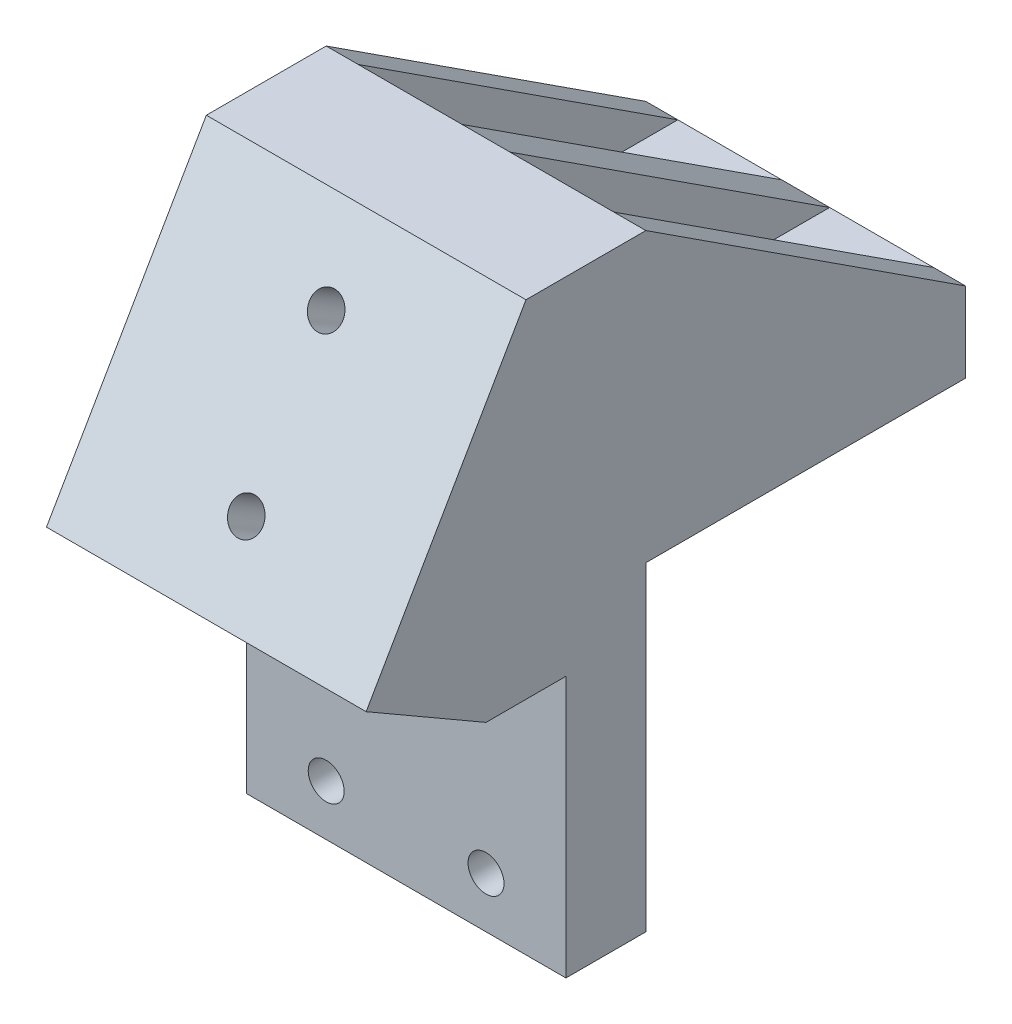
from build123d import *

# Parameters (mm, degrees)
BOSS_EXTRU_1_DEPTH           = 40
ENL_V_MAT_EXTRU_1_DEPTH      = 76.498344353
ENL_V_MAT_EXTRU_1_DEPTH_BACK = 76.498344353
ESQUISSE2_R                  = 2.25
ENL_V_MAT_EXTRU_2_DEPTH      = 76.498344353
ENL_V_MAT_EXTRU_2_DEPTH_BACK = 76.498344353
ESQUISSE3_R                  = 2.25
ENL_V_MAT_EXTRU_3_DEPTH      = 96.640449297
ENL_V_MAT_EXTRU_3_DEPTH_BACK = 20
ESQUISSE4_R                  = 2.1
BOSS_EXTRU_2_DEPTH           = 4
BOSS_EXTRU_3_START           = -40
BOSS_EXTRU_3_DEPTH           = 4
BOSS_EXTRU_4_DEPTH           = 3
BOSS_EXTRU_4_DEPTH_BACK      = 3
BOSS_EXTRU_4_START           = -20


with BuildPart() as part:
    # Esquisse1 → Boss.-Extru.1 (new body)
    with BuildSketch(Plane(origin=(0, 0, 0), x_dir=(0, 0, -1), z_dir=(1, 0, 0))):
        Polygon((0, 0), (40, 0), (40, 10), (0, 10), (0, 36), (-15, 36), (-35, 1.358983849), (-20, -7.301270189), (-10, -7.301270189), (-10, -40), (0, -40), align=None)
    extrude(amount=BOSS_EXTRU_1_DEPTH)

    # Esquisse2 → Enlèv. mat.-Extru.1 (cut, two sides: drawn at the far end of the back side and taken through both)
    with BuildSketch(Plane(origin=(0, 10, 0), x_dir=(1, 0, 0), z_dir=(0, 1, 0)).offset(-ENL_V_MAT_EXTRU_1_DEPTH_BACK)):
        with Locations(Location((10, 30, 0), (0, 0, 270))):
            Circle(ESQUISSE2_R)
        with Locations(Location((30, 30, 0), (0, 0, 270))):
            Circle(ESQUISSE2_R)
        with Locations(Location((30, 10, 0), (0, 0, 270))):
            Circle(ESQUISSE2_R)
        with Locations(Location((10, 10, 0), (0, 0, 270))):
            Circle(ESQUISSE2_R)
    extrude(amount=ENL_V_MAT_EXTRU_1_DEPTH + ENL_V_MAT_EXTRU_1_DEPTH_BACK, mode=Mode.SUBTRACT)

    # Esquisse3 → Enlèv. mat.-Extru.2 (cut, two sides: drawn at the far end of the back side and taken through both)
    with BuildSketch(Plane.XY.offset(10).offset(-ENL_V_MAT_EXTRU_2_DEPTH_BACK)):
        with Locations((10, -33.650635095)):
            Circle(ESQUISSE3_R)
        with Locations((30, -33.650635095)):
            Circle(ESQUISSE3_R)
        with Locations((30, -13.650635095)):
            Circle(ESQUISSE3_R)
        with Locations((10, -13.650635095)):
            Circle(ESQUISSE3_R)
    extrude(amount=ENL_V_MAT_EXTRU_2_DEPTH + ENL_V_MAT_EXTRU_2_DEPTH_BACK, mode=Mode.SUBTRACT)

    # Esquisse4 → Enlèv. mat.-Extru.3 (cut, two sides: drawn at the far end of the back side and taken through both)
    with BuildSketch(Plane(origin=(0, 15.495190528, 26.838457268), x_dir=(1, 0, 0), z_dir=(0, 0.4999999999999946, 0.8660254037844419)).offset(-ENL_V_MAT_EXTRU_3_DEPTH_BACK)):
        with Locations(Location((20, 13.676914536, 0), (0, 0, 90))):
            Circle(ESQUISSE4_R)
        with Locations(Location((20, -6.323085464, 0), (0, 0, 90))):
            Circle(ESQUISSE4_R)
    extrude(amount=ENL_V_MAT_EXTRU_3_DEPTH + ENL_V_MAT_EXTRU_3_DEPTH_BACK, mode=Mode.SUBTRACT)

    # Esquisse5 → Boss.-Extru.2 (add)
    with BuildSketch(Plane(origin=(40, 0, 0), x_dir=(0, 0, -1), z_dir=(1, 0, 0))):
        Polygon((40, 10), (0, 36), (0, 10), align=None)
    extrude(amount=-BOSS_EXTRU_2_DEPTH)

    # Esquisse5<2> → Boss.-Extru.3 (add)
    with BuildSketch(Plane(origin=(40, 0, 0), x_dir=(0, 0, -1), z_dir=(1, 0, 0)).offset(BOSS_EXTRU_3_START)):
        Polygon((40, 10), (0, 36), (0, 10), align=None)
    extrude(amount=BOSS_EXTRU_3_DEPTH)

    # Esquisse5<3> → Boss.-Extru.4 (add, two sides: drawn at the far end of the back side and taken through both)
    with BuildSketch(Plane(origin=(40, 0, 0), x_dir=(0, 0, -1), z_dir=(1, 0, 0)).offset(BOSS_EXTRU_4_START - BOSS_EXTRU_4_DEPTH_BACK)):
        Polygon((40, 10), (0, 36), (0, 10), align=None)
    extrude(amount=BOSS_EXTRU_4_DEPTH + BOSS_EXTRU_4_DEPTH_BACK)


solid = part.part
